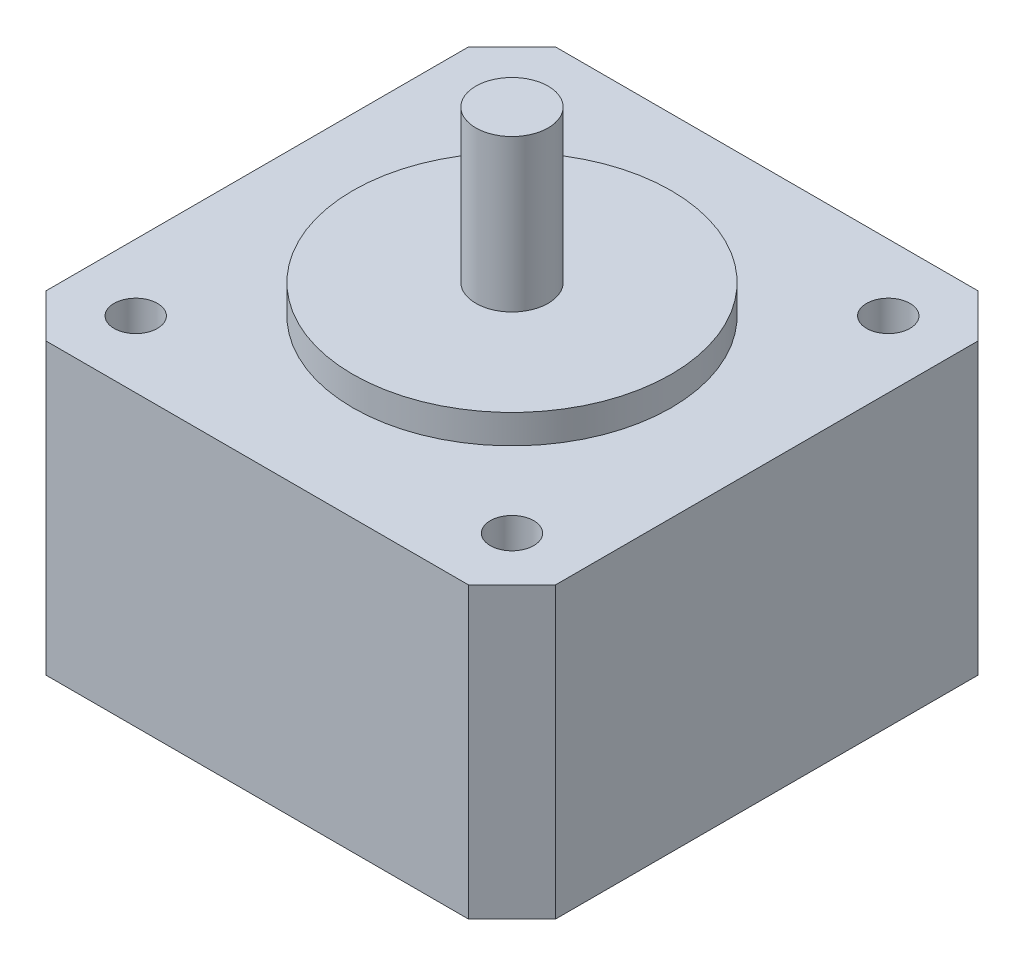
from build123d import *

# Parameters (mm, degrees)
SKETCH1_W           = 35.2
SKETCH1_H           = 35.2
BOSS_EXTRUDE1_DEPTH = 20
SKETCH2_R           = 11
BOSS_EXTRUDE2_DEPTH = 2
SKETCH3_R           = 2.5
BOSS_EXTRUDE3_DEPTH = 10.5
SKETCH4_R           = 1.5
CUT_EXTRUDE1_DEPTH  = 4.5
CHAMFER1_SIZE       = 3


with BuildPart() as part:
    # Sketch1 → Boss-Extrude1 (new body)
    with BuildSketch(Plane(origin=(0, 0, 0), x_dir=(1, 0, 0), z_dir=(0, 1, 0))):
        Rectangle(SKETCH1_W, SKETCH1_H)
    extrude(amount=BOSS_EXTRUDE1_DEPTH)

    # Sketch2 → Boss-Extrude2 (add)
    with BuildSketch(Plane(origin=(0, 20, 0), x_dir=(1, 0, 0), z_dir=(0, 1, 0))):
        with Locations(Location((0, 0, 0), (0, 0, 270))):
            Circle(SKETCH2_R)
    extrude(amount=BOSS_EXTRUDE2_DEPTH)

    # Sketch3 → Boss-Extrude3 (add)
    with BuildSketch(Plane(origin=(0, 22, 0), x_dir=(1, 0, 0), z_dir=(0, 1, 0))):
        with Locations(Location((0, 0, 0), (0, 0, 90))):
            Circle(SKETCH3_R)
    extrude(amount=BOSS_EXTRUDE3_DEPTH)

    # Sketch4 → Cut-Extrude1 (cut)
    with BuildSketch(Plane(origin=(0, 20, 0), x_dir=(1, 0, 0), z_dir=(0, 1, 0))):
        with Locations(Location((-13, 13, 0), (0, 0, 270))):
            Circle(SKETCH4_R)
        with Locations(Location((13, 13, 0), (0, 0, 270))):
            Circle(SKETCH4_R)
        with Locations(Location((13, -13, 0), (0, 0, 270))):
            Circle(SKETCH4_R)
        with Locations(Location((-13, -13, 0), (0, 0, 270))):
            Circle(SKETCH4_R)
    extrude(amount=-CUT_EXTRUDE1_DEPTH, mode=Mode.SUBTRACT)

    # Chamfer1
    chamfer1_edges = [part.edges().sort_by_distance(p)[0] for p in [
        (17.6, 10, 17.6),
        (-17.6, 10, 17.6),
        (-17.6, 10, -17.6),
        (17.6, 10, -17.6),
    ]]
    chamfer(chamfer1_edges, length=CHAMFER1_SIZE)


solid = part.part
